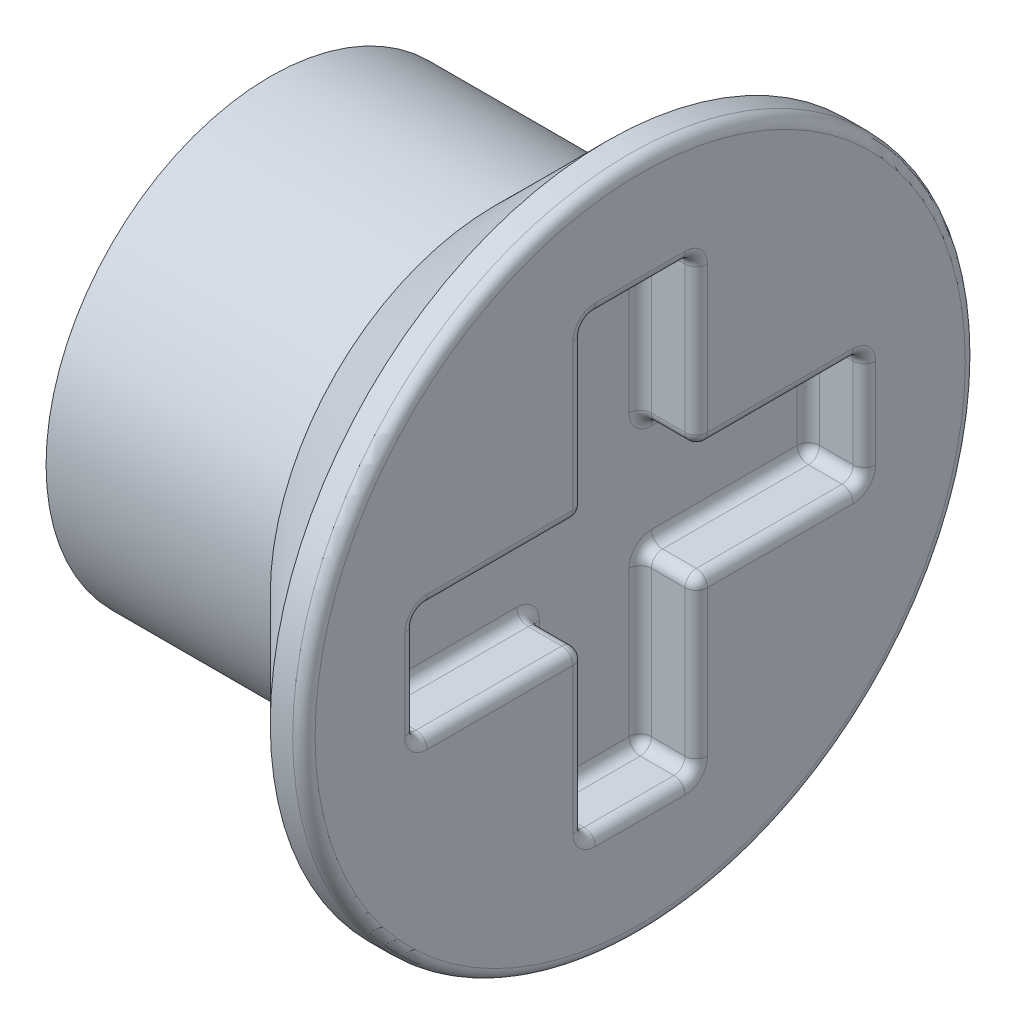
from build123d import *

# Parameters (mm, degrees)
SKETCH1_R           = 3
BOSS_EXTRUDE1_DEPTH = 1.3
CHAMFER1_SIZE       = 1
SKETCH2_R           = 2
BOSS_EXTRUDE2_DEPTH = 2
SKETCH3_W           = 1
SKETCH3_H           = 1.5
SKETCH3_H_2         = 1
SKETCH3_W_2         = 1.5
CUT_EXTRUDE1_DEPTH  = 0.5
FILLET1_R           = 0.1


with BuildPart() as part:
    # Sketch1 → Boss-Extrude1 (new body)
    with BuildSketch(Plane(origin=(0, 0, 0), x_dir=(0, 0, -1), z_dir=(1, 0, 0))):
        Circle(SKETCH1_R)
    extrude(amount=BOSS_EXTRUDE1_DEPTH)

    # Chamfer1
    chamfer1_edges = [part.edges().sort_by_distance(p)[0] for p in [
        (0, 0, 3),
    ]]
    chamfer(chamfer1_edges, length=CHAMFER1_SIZE)

    # Sketch2 → Boss-Extrude2 (add)
    with BuildSketch(Plane.ZY):
        with Locations(Location((0, 0, 0), (0, 0, 180))):
            Circle(SKETCH2_R)
    extrude(amount=BOSS_EXTRUDE2_DEPTH)

    # Sketch3 → Cut-Extrude1 (cut)
    with BuildSketch(Plane(origin=(1.3, 0, 0), x_dir=(0, 0, -1), z_dir=(1, 0, 0))):
        with Locations((0, 1.25)):
            Rectangle(SKETCH3_W, SKETCH3_H)
        Rectangle(SKETCH3_W, SKETCH3_H_2)
        with Locations((0, -1.25)):
            Rectangle(SKETCH3_W, SKETCH3_H)
        with Locations((-1.25, 0)):
            Rectangle(SKETCH3_W_2, SKETCH3_H_2)
        with Locations((1.25, 0)):
            Rectangle(SKETCH3_W_2, SKETCH3_H_2)
    extrude(amount=-CUT_EXTRUDE1_DEPTH, mode=Mode.SUBTRACT)

    # Fillet1
    fillet1_edges = [part.edges().sort_by_distance(p)[0] for p in [
        (1.3, 1.25, 0.5),
        (1.05, 0.5, 0.5),
        (1.3, 2, 0),
        (1.05, 2, 0.5),
        (0.8, 1.25, -0.5),
        (1.05, 2, -0.5),
        (1.3, 0.5, -1.25),
        (1.05, 0.5, -0.5),
        (0.8, 0, -2),
        (1.05, 0.5, -2),
        (0.8, -0.5, -1.25),
        (1.05, -0.5, -2),
        (0.8, -1.25, -0.5),
        (1.05, -0.5, -0.5),
        (0.8, -2, 0),
        (1.05, -2, -0.5),
        (1.3, -1.25, 0.5),
        (1.05, -2, 0.5),
        (0.8, -0.5, 1.25),
        (1.05, -0.5, 0.5),
        (1.3, 0, 2),
        (1.05, -0.5, 2),
        (1.3, 0.5, 1.25),
        (1.05, 0.5, 2),
        (0.8, 1.25, 0.5),
        (0.8, 2, 0),
        (0.8, 0.5, -1.25),
        (0.8, -1.25, 0.5),
        (0.8, 0, 2),
        (0.8, 0.5, 1.25),
        (1.3, -0.5, 1.25),
        (1.3, -2, 0),
        (1.3, -1.25, -0.5),
        (1.3, -0.5, -1.25),
        (1.3, 0, -2),
        (1.3, 1.25, -0.5),
        (1.3, 0, 3),
    ]]
    fillet(fillet1_edges, radius=FILLET1_R)


solid = part.part
